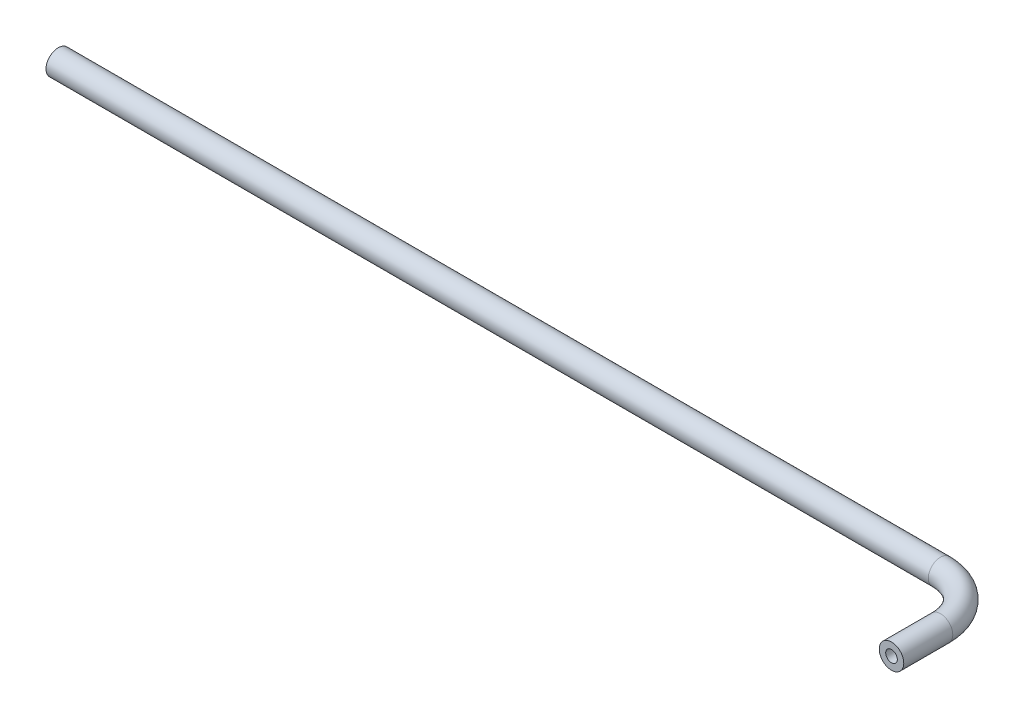
from build123d import *

# Parameters (mm, degrees)
SKETCH2_R   = 3.175
SKETCH2_R_2 = 1.5


with BuildPart() as part:
    # Sweep1: sweep along a path in Sketch1
    with BuildLine(Plane(origin=(0, 0, 0), x_dir=(1, 0, 0), z_dir=(0, 1, 0))) as sweep1_path:
        Line((-241.3, 0), (-12.7, 0))
        ThreePointArc((-12.7, 0), (-3.719743879, -3.719743879), (0, -12.7))
        Line((0, -12.7), (0, -25.4))
    # Sketch2 → Sweep1 (sweep)
    with BuildSketch(Plane(origin=(-241.3, 0, 0), x_dir=(0, 0, -1), z_dir=(1, 0, 0))):
        Circle(SKETCH2_R)
        Circle(SKETCH2_R_2, mode=Mode.SUBTRACT)
    sweep(path=sweep1_path.line)


solid = part.part
